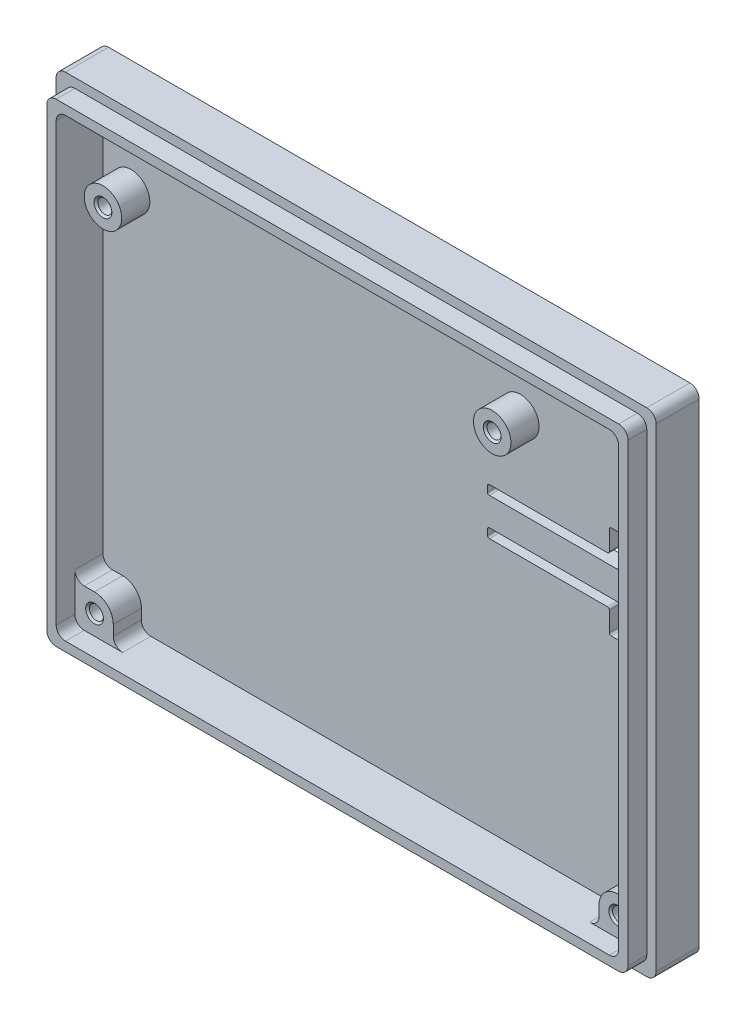
from build123d import *

# Parameters (mm, degrees)
SKETCH1_W           = 64.05
SKETCH1_H           = 52.6
BOSS_EXTRUDE1_DEPTH = 1.6
SKETCH2_W           = 64.05
SKETCH2_H           = 52.6
SKETCH2_W_2         = 60.05
SKETCH2_H_2         = 48.6
BOSS_EXTRUDE2_DEPTH = 3
SKETCH6_W           = 62.05
SKETCH6_H           = 50.6
SKETCH6_W_2         = 60.05
SKETCH6_H_2         = 48.6
BOSS_EXTRUDE6_DEPTH = 2
CUT_EXTRUDE2_DEPTH  = 2
FILLET2_R           = 0.2
SKETCH11_R          = 2
BOSS_EXTRUDE7_DEPTH = 3
SKETCH12_R          = 0.75
CUT_EXTRUDE3_DEPTH  = 2
FILLET4_R           = 1
BOSS_EXTRUDE8_DEPTH = 3
FILLET5_R           = 1
CHAMFER2_SIZE       = 0.2


with BuildPart() as part:
    # Sketch1 → Boss-Extrude1 (new body)
    with BuildSketch(Plane.XY):
        with Locations((29.525, 23.8)):
            Rectangle(SKETCH1_W, SKETCH1_H)
    extrude(amount=BOSS_EXTRUDE1_DEPTH)

    # Sketch2 → Boss-Extrude2 (add)
    with BuildSketch(Plane.XY.offset(1.6)):
        with Locations((29.525, 23.8)):
            Rectangle(SKETCH2_W, SKETCH2_H)
        with Locations((29.525, 23.8)):
            Rectangle(SKETCH2_W_2, SKETCH2_H_2, mode=Mode.SUBTRACT)
    extrude(amount=BOSS_EXTRUDE2_DEPTH)

    # Sketch6 → Boss-Extrude6 (add)
    with BuildSketch(Plane.XY.offset(4.6)):
        with Locations((29.525, 23.8)):
            Rectangle(SKETCH6_W, SKETCH6_H)
        with Locations((29.525, 23.8)):
            Rectangle(SKETCH6_W_2, SKETCH6_H_2, mode=Mode.SUBTRACT)
    extrude(amount=BOSS_EXTRUDE6_DEPTH)

    # Sketch9 → Cut-Extrude2 (cut)
    with BuildSketch(Plane(origin=(0, 0, 0), x_dir=(-1, 0, 0), z_dir=(0, 0, -1))):
        Polygon((-40.55, 27.6), (-54.55, 27.6), (-54.55, 25.1), (-57.55, 25.1), (-57.55, 33.1), (-54.55, 33.1), (-54.55, 30.6), (-40.55, 30.6), (-40.55, 31.6), (-53.55, 31.6), (-53.55, 34.1), (-58.55, 34.1), (-58.55, 24.1), (-53.55, 24.1), (-53.55, 26.6), (-40.55, 26.6), align=None)
    extrude(amount=-CUT_EXTRUDE2_DEPTH, mode=Mode.SUBTRACT)

    # Fillet2
    fillet2_edges = [part.edges().sort_by_distance(p)[0] for p in [
        (40.55, 27.6, 0.8),
        (40.55, 26.6, 0.8),
        (53.55, 26.6, 0.8),
        (53.55, 24.1, 0.8),
        (58.55, 24.1, 0.8),
        (58.55, 34.1, 0.8),
        (53.55, 34.1, 0.8),
        (53.55, 31.6, 0.8),
        (40.55, 31.6, 0.8),
        (40.55, 30.6, 0.8),
        (54.55, 30.6, 0.8),
        (54.55, 33.1, 0.8),
        (57.55, 33.1, 0.8),
        (57.55, 25.1, 0.8),
        (54.55, 25.1, 0.8),
        (54.55, 27.6, 0.8),
    ]]
    fillet(fillet2_edges, radius=FILLET2_R)

    # Sketch11 → Boss-Extrude7 (add)
    with BuildSketch(Plane.XY.offset(1.6)):
        with Locations(Location((1.6, 1.6, 0), (0, 0, 180))):
            Circle(SKETCH11_R)
        with Locations(Location((57.45, 1.6, 0), (0, 0, 180))):
            Circle(SKETCH11_R)
        with Locations(Location((44.05, 39.6, 0), (0, 0, 180))):
            Circle(SKETCH11_R)
        with Locations(Location((2.5, 39.6, 0), (0, 0, 180))):
            Circle(SKETCH11_R)
    extrude(amount=BOSS_EXTRUDE7_DEPTH)

    # Sketch12 → Cut-Extrude3 (cut)
    with BuildSketch(Plane.XY.offset(4.6)):
        with Locations((2.5, 39.6)):
            Circle(SKETCH12_R)
        with Locations((1.6, 1.6)):
            Circle(SKETCH12_R)
        with Locations((57.45, 1.6)):
            Circle(SKETCH12_R)
        with Locations((44.05, 39.6)):
            Circle(SKETCH12_R)
    extrude(amount=-CUT_EXTRUDE3_DEPTH, mode=Mode.SUBTRACT)

    # Fillet4
    fillet4_edges = [part.edges().sort_by_distance(p)[0] for p in [
        (59.55, 48.1, 4.1),
        (-0.5, 48.1, 4.1),
        (-1.5, -1.5, 5.6),
        (60.55, -1.5, 5.6),
        (60.55, 49.1, 5.6),
        (-1.5, 49.1, 5.6),
        (-2.5, 50.1, 2.3),
        (61.55, 50.1, 2.3),
        (61.55, -2.5, 2.3),
        (-2.5, -2.5, 2.3),
    ]]
    fillet(fillet4_edges, radius=FILLET4_R)

    # Sketch13 → Boss-Extrude8 (add)
    with BuildSketch(Plane.XY.offset(1.6)):
        with BuildLine():
            Line((1.6, 3.6), (-0.5, 3.6))
            Line((-0.5, 3.6), (-0.5, -0.5))
            Line((-0.5, -0.5), (3.6, -0.5))
            Line((3.6, -0.5), (3.6, 1.6))
            ThreePointArc((3.6, 1.6), (0.185786438, 0.185786438), (1.6, 3.6))
        make_face()
    boss_extrude8 = extrude(amount=BOSS_EXTRUDE8_DEPTH)

    # Mirror1: Boss-Extrude8 across plane
    add(boss_extrude8.mirror(Plane(origin=(29.525, 0, 0), x_dir=(0, 0, 1), z_dir=(1, 0, 0))))

    # Fillet5
    fillet5_edges = [part.edges().sort_by_distance(p)[0] for p in [
        (-0.5, -0.5, 5.6),
        (59.55, -0.5, 5.6),
        (-0.5, 3.6, 3.1),
        (3.6, -0.5, 3.1),
        (59.55, 3.6, 3.1),
        (55.45, -0.5, 3.1),
    ]]
    fillet(fillet5_edges, radius=FILLET5_R)

    # Chamfer2
    chamfer2_edges = [part.edges().sort_by_distance(p)[0] for p in [
        (1.75, 39.6, 4.6),
        (0.85, 1.6, 4.6),
        (56.7, 1.6, 4.6),
        (43.3, 39.6, 4.6),
    ]]
    chamfer(chamfer2_edges, length=CHAMFER2_SIZE)


solid = part.part
